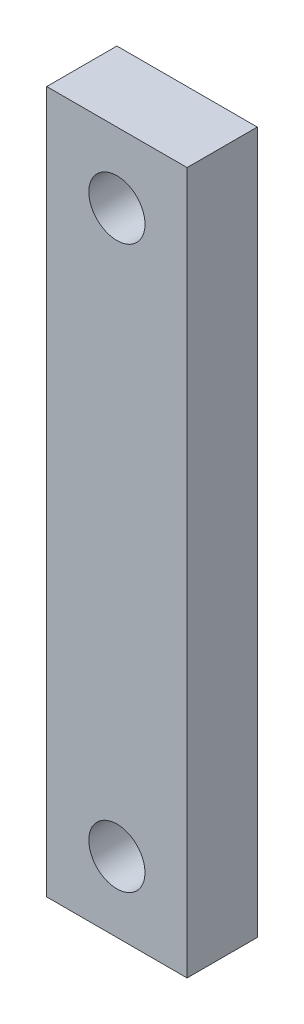
from build123d import *

# Parameters (mm, degrees)
ESQUISSE1_W             = 20
ESQUISSE1_H             = 100
BOSS_EXTRU_1_DEPTH      = 10
ESQUISSE2_R             = 4
ENL_V_MAT_EXTRU_1_DEPTH = 103.46950766


with BuildPart() as part:
    # Esquisse1 → Boss.-Extru.1 (new body)
    with BuildSketch(Plane.XY):
        with Locations((10, 50)):
            Rectangle(ESQUISSE1_W, ESQUISSE1_H)
    extrude(amount=BOSS_EXTRU_1_DEPTH)

    # Esquisse2 → Enlèv. mat.-Extru.1 (cut, through all)
    with BuildSketch(Plane.XY.offset(10)):
        with Locations((10, 90)):
            Circle(ESQUISSE2_R)
        with Locations(Location((10, 10, 0), (0, 0, 180))):
            Circle(ESQUISSE2_R)
    extrude(amount=-ENL_V_MAT_EXTRU_1_DEPTH, mode=Mode.SUBTRACT)


solid = part.part
